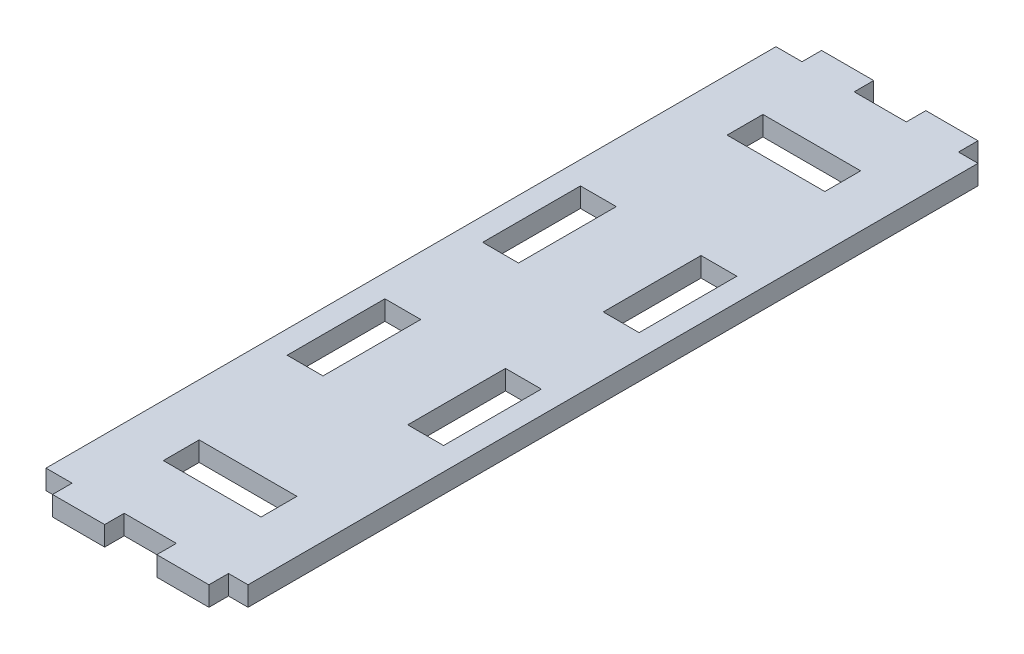
from build123d import *

# Parameters (mm, degrees)
SKETCH1_W           = 15
SKETCH1_H           = 5.5
SKETCH1_W_2         = 5.5
SKETCH1_H_2         = 15
BOSS_EXTRUDE1_DEPTH = 3


with BuildPart() as part:
    # Sketch1 → Boss-Extrude1 (new body)
    with BuildSketch(Plane(origin=(0, 0, 0), x_dir=(1, 0, 0), z_dir=(0, 1, 0))):
        Polygon((0, 56), (0, -56), (-3, -56), (-3, -59), (-11, -59), (-11, -56), (-19, -56), (-19, -59), (-27, -59), (-27, -56), (-31, -56), (-31, 56), (-27, 56), (-27, 59), (-19, 59), (-19, 56), (-11, 56), (-11, 59), (-3, 59), (-3, 56), align=None)
        with Locations((-15.5, -43.25)):
            Rectangle(SKETCH1_W, SKETCH1_H, mode=Mode.SUBTRACT)
        with Locations((-24.75, -15)):
            Rectangle(SKETCH1_W_2, SKETCH1_H_2, mode=Mode.SUBTRACT)
        with Locations((-6.25, -15)):
            Rectangle(SKETCH1_W_2, SKETCH1_H_2, mode=Mode.SUBTRACT)
        with Locations((-24.75, 15)):
            Rectangle(SKETCH1_W_2, SKETCH1_H_2, mode=Mode.SUBTRACT)
        with Locations((-6.25, 15)):
            Rectangle(SKETCH1_W_2, SKETCH1_H_2, mode=Mode.SUBTRACT)
        with Locations((-15.5, 43.25)):
            Rectangle(SKETCH1_W, SKETCH1_H, mode=Mode.SUBTRACT)
    extrude(amount=BOSS_EXTRUDE1_DEPTH)


solid = part.part
